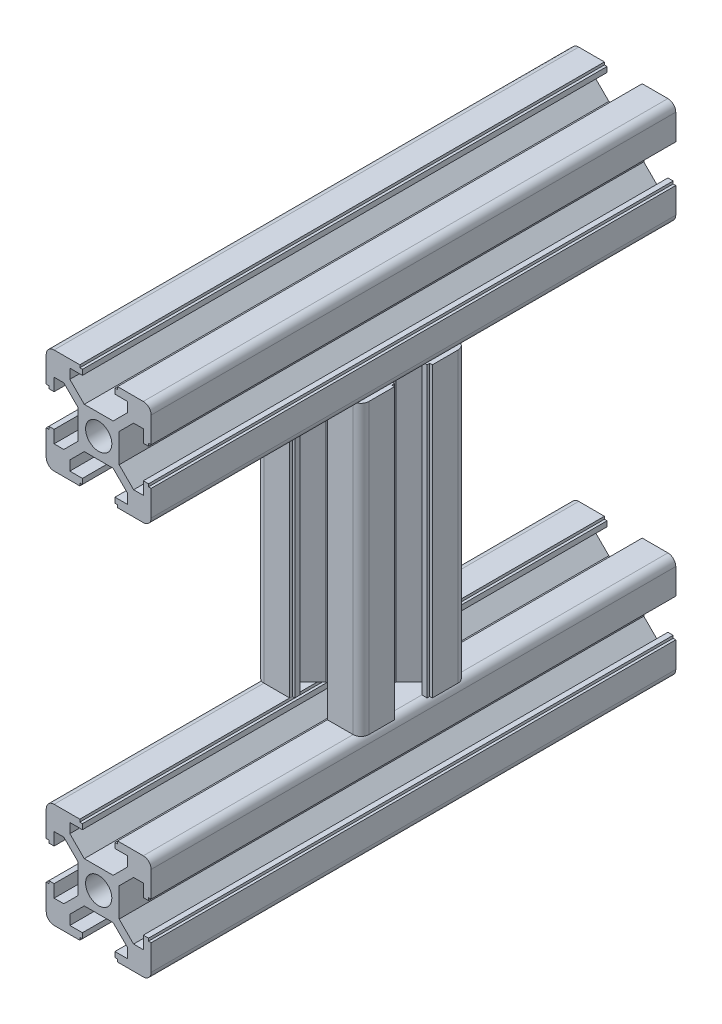
from build123d import *

# Parameters (mm, degrees)
SKETCH_3_R       = 2.5
EXTRUDE_3_DEPTH  = 100
EXTRUDE_START    = 10
SKETCH_6_R       = 2.5
EXTRUDE_9_DEPTH  = 55
EXTRUDE_START_2  = -53.9
SKETCH_7_R       = 2.5
EXTRUDE_10_DEPTH = 100


with BuildPart() as part:
    # 草图3 → 凸台-拉伸3 (new body)
    with BuildSketch(Plane.XY):
        with BuildLine():
            Line((-3.6, 10), (-3.6, 9.5))
            Line((-3.6, 9.5), (-3.1, 9.5))
            Line((-3.1, 9.5), (-3.1, 8.5))
            Line((-3.1, 8.5), (-5.5, 8.5))
            Line((-5.5, 8.5), (-5.5, 6.65))
            Line((-5.5, 6.65), (-2.75, 3.9))
            Line((-2.75, 3.9), (2.75, 3.9))
            Line((2.75, 3.9), (5.5, 6.65))
            Line((5.5, 6.65), (5.5, 8.5))
            Line((5.5, 8.5), (3.1, 8.5))
            Line((3.1, 8.5), (3.1, 9.5))
            Line((3.1, 9.5), (3.6, 9.5))
            Line((3.6, 9.5), (3.6, 10))
            Line((3.6, 10), (8.5, 10))
            ThreePointArc((8.5, 10), (9.560660172, 9.560660172), (10, 8.5))
            Line((10, 8.5), (10, 3.6))
            Line((10, 3.6), (9.5, 3.6))
            Line((9.5, 3.6), (9.5, 3.1))
            Line((9.5, 3.1), (8.5, 3.1))
            Line((8.5, 3.1), (8.5, 5.5))
            Line((8.5, 5.5), (6.65, 5.5))
            Line((6.65, 5.5), (3.9, 2.75))
            Line((3.9, 2.75), (3.9, -2.75))
            Line((3.9, -2.75), (6.65, -5.5))
            Line((6.65, -5.5), (8.5, -5.5))
            Line((8.5, -5.5), (8.5, -3.1))
            Line((8.5, -3.1), (9.5, -3.1))
            Line((9.5, -3.1), (9.5, -3.6))
            Line((9.5, -3.6), (10, -3.6))
            Line((10, -3.6), (10, -8.5))
            ThreePointArc((10, -8.5), (9.560660172, -9.560660172), (8.5, -10))
            Line((8.5, -10), (3.6, -10))
            Line((3.6, -10), (3.6, -9.5))
            Line((3.6, -9.5), (3.1, -9.5))
            Line((3.1, -9.5), (3.1, -8.5))
            Line((3.1, -8.5), (5.5, -8.5))
            Line((5.5, -8.5), (5.5, -6.65))
            Line((5.5, -6.65), (2.75, -3.9))
            Line((2.75, -3.9), (-2.75, -3.9))
            Line((-2.75, -3.9), (-5.5, -6.65))
            Line((-5.5, -6.65), (-5.5, -8.5))
            Line((-5.5, -8.5), (-3.1, -8.5))
            Line((-3.1, -8.5), (-3.1, -9.5))
            Line((-3.1, -9.5), (-3.6, -9.5))
            Line((-3.6, -9.5), (-3.6, -10))
            Line((-3.6, -10), (-8.5, -10))
            ThreePointArc((-8.5, -10), (-9.560660172, -9.560660172), (-10, -8.5))
            Line((-10, -8.5), (-10, -3.6))
            Line((-10, -3.6), (-9.5, -3.6))
            Line((-9.5, -3.6), (-9.5, -3.1))
            Line((-9.5, -3.1), (-8.5, -3.1))
            Line((-8.5, -3.1), (-8.5, -5.5))
            Line((-8.5, -5.5), (-6.65, -5.5))
            Line((-6.65, -5.5), (-3.9, -2.75))
            Line((-3.9, -2.75), (-3.9, 2.75))
            Line((-3.9, 2.75), (-6.65, 5.5))
            Line((-6.65, 5.5), (-8.5, 5.5))
            Line((-8.5, 5.5), (-8.5, 3.1))
            Line((-8.5, 3.1), (-9.5, 3.1))
            Line((-9.5, 3.1), (-9.5, 3.6))
            Line((-9.5, 3.6), (-10, 3.6))
            Line((-10, 3.6), (-10, 8.5))
            ThreePointArc((-10, 8.5), (-9.560660172, 9.560660172), (-8.5, 10))
            Line((-8.5, 10), (-3.6, 10))
        make_face()
        Circle(SKETCH_3_R, mode=Mode.SUBTRACT)
    extrude(amount=EXTRUDE_3_DEPTH)


with BuildPart() as body_2:
    # 草图6 → 凸台-拉伸9 (new body)
    with BuildSketch(Plane(origin=(0, 0, 0), x_dir=(1, 0, 0), z_dir=(0, 1, 0)).offset(EXTRUDE_START)):
        with BuildLine():
            Line((-3.6, -40), (-3.6, -40.5))
            Line((-3.6, -40.5), (-3.1, -40.5))
            Line((-3.1, -40.5), (-3.1, -41.5))
            Line((-3.1, -41.5), (-5.5, -41.5))
            Line((-5.5, -41.5), (-5.5, -43.35))
            Line((-5.5, -43.35), (-2.75, -46.1))
            Line((-2.75, -46.1), (2.75, -46.1))
            Line((2.75, -46.1), (5.5, -43.35))
            Line((5.5, -43.35), (5.5, -41.5))
            Line((5.5, -41.5), (3.1, -41.5))
            Line((3.1, -41.5), (3.1, -40.5))
            Line((3.1, -40.5), (3.6, -40.5))
            Line((3.6, -40.5), (3.6, -40))
            Line((3.6, -40), (8.5, -40))
            ThreePointArc((8.5, -40), (9.560660172, -40.439339828), (10, -41.5))
            Line((10, -41.5), (10, -46.4))
            Line((10, -46.4), (9.5, -46.4))
            Line((9.5, -46.4), (9.5, -46.9))
            Line((9.5, -46.9), (8.5, -46.9))
            Line((8.5, -46.9), (8.5, -44.5))
            Line((8.5, -44.5), (6.65, -44.5))
            Line((6.65, -44.5), (3.9, -47.25))
            Line((3.9, -47.25), (3.9, -52.75))
            Line((3.9, -52.75), (6.65, -55.5))
            Line((6.65, -55.5), (8.5, -55.5))
            Line((8.5, -55.5), (8.5, -53.1))
            Line((8.5, -53.1), (9.5, -53.1))
            Line((9.5, -53.1), (9.5, -53.6))
            Line((9.5, -53.6), (10, -53.6))
            Line((10, -53.6), (10, -58.5))
            ThreePointArc((10, -58.5), (9.560660172, -59.560660172), (8.5, -60))
            Line((8.5, -60), (3.6, -60))
            Line((3.6, -60), (3.6, -59.5))
            Line((3.6, -59.5), (3.1, -59.5))
            Line((3.1, -59.5), (3.1, -58.5))
            Line((3.1, -58.5), (5.5, -58.5))
            Line((5.5, -58.5), (5.5, -56.65))
            Line((5.5, -56.65), (2.75, -53.9))
            Line((2.75, -53.9), (-2.75, -53.9))
            Line((-2.75, -53.9), (-5.5, -56.65))
            Line((-5.5, -56.65), (-5.5, -58.5))
            Line((-5.5, -58.5), (-3.1, -58.5))
            Line((-3.1, -58.5), (-3.1, -59.5))
            Line((-3.1, -59.5), (-3.6, -59.5))
            Line((-3.6, -59.5), (-3.6, -60))
            Line((-3.6, -60), (-8.5, -60))
            ThreePointArc((-8.5, -60), (-9.560660172, -59.560660172), (-10, -58.5))
            Line((-10, -58.5), (-10, -53.6))
            Line((-10, -53.6), (-9.5, -53.6))
            Line((-9.5, -53.6), (-9.5, -53.1))
            Line((-9.5, -53.1), (-8.5, -53.1))
            Line((-8.5, -53.1), (-8.5, -55.5))
            Line((-8.5, -55.5), (-6.65, -55.5))
            Line((-6.65, -55.5), (-3.9, -52.75))
            Line((-3.9, -52.75), (-3.9, -47.25))
            Line((-3.9, -47.25), (-6.65, -44.5))
            Line((-6.65, -44.5), (-8.5, -44.5))
            Line((-8.5, -44.5), (-8.5, -46.9))
            Line((-8.5, -46.9), (-9.5, -46.9))
            Line((-9.5, -46.9), (-9.5, -46.4))
            Line((-9.5, -46.4), (-10, -46.4))
            Line((-10, -46.4), (-10, -41.5))
            ThreePointArc((-10, -41.5), (-9.560660172, -40.439339828), (-8.5, -40))
            Line((-8.5, -40), (-3.6, -40))
        make_face()
        with Locations((0, -50)):
            Circle(SKETCH_6_R, mode=Mode.SUBTRACT)
    extrude(amount=EXTRUDE_9_DEPTH)


with BuildPart() as body_3:
    # 草图7 → 凸台-拉伸10 (new body)
    with BuildSketch(Plane(origin=(0, 0, 46.1), x_dir=(-1, 0, 0), z_dir=(0, 0, -1)).offset(EXTRUDE_START_2)):
        with BuildLine():
            Line((-3.6, 85), (-3.6, 84.5))
            Line((-3.6, 84.5), (-3.1, 84.5))
            Line((-3.1, 84.5), (-3.1, 83.5))
            Line((-3.1, 83.5), (-5.5, 83.5))
            Line((-5.5, 83.5), (-5.5, 81.65))
            Line((-5.5, 81.65), (-2.75, 78.9))
            Line((-2.75, 78.9), (2.75, 78.9))
            Line((2.75, 78.9), (5.5, 81.65))
            Line((5.5, 81.65), (5.5, 83.5))
            Line((5.5, 83.5), (3.1, 83.5))
            Line((3.1, 83.5), (3.1, 84.5))
            Line((3.1, 84.5), (3.6, 84.5))
            Line((3.6, 84.5), (3.6, 85))
            Line((3.6, 85), (8.5, 85))
            ThreePointArc((8.5, 85), (9.560660172, 84.560660172), (10, 83.5))
            Line((10, 83.5), (10, 78.6))
            Line((10, 78.6), (9.5, 78.6))
            Line((9.5, 78.6), (9.5, 78.1))
            Line((9.5, 78.1), (8.5, 78.1))
            Line((8.5, 78.1), (8.5, 80.5))
            Line((8.5, 80.5), (6.65, 80.5))
            Line((6.65, 80.5), (3.9, 77.75))
            Line((3.9, 77.75), (3.9, 72.25))
            Line((3.9, 72.25), (6.65, 69.5))
            Line((6.65, 69.5), (8.5, 69.5))
            Line((8.5, 69.5), (8.5, 71.9))
            Line((8.5, 71.9), (9.5, 71.9))
            Line((9.5, 71.9), (9.5, 71.4))
            Line((9.5, 71.4), (10, 71.4))
            Line((10, 71.4), (10, 66.5))
            ThreePointArc((10, 66.5), (9.560660172, 65.439339828), (8.5, 65))
            Line((8.5, 65), (3.6, 65))
            Line((3.6, 65), (3.6, 65.5))
            Line((3.6, 65.5), (3.1, 65.5))
            Line((3.1, 65.5), (3.1, 66.5))
            Line((3.1, 66.5), (5.5, 66.5))
            Line((5.5, 66.5), (5.5, 68.35))
            Line((5.5, 68.35), (2.75, 71.1))
            Line((2.75, 71.1), (-2.75, 71.1))
            Line((-2.75, 71.1), (-5.5, 68.35))
            Line((-5.5, 68.35), (-5.5, 66.5))
            Line((-5.5, 66.5), (-3.1, 66.5))
            Line((-3.1, 66.5), (-3.1, 65.5))
            Line((-3.1, 65.5), (-3.6, 65.5))
            Line((-3.6, 65.5), (-3.6, 65))
            Line((-3.6, 65), (-8.5, 65))
            ThreePointArc((-8.5, 65), (-9.560660172, 65.439339828), (-10, 66.5))
            Line((-10, 66.5), (-10, 71.4))
            Line((-10, 71.4), (-9.5, 71.4))
            Line((-9.5, 71.4), (-9.5, 71.9))
            Line((-9.5, 71.9), (-8.5, 71.9))
            Line((-8.5, 71.9), (-8.5, 69.5))
            Line((-8.5, 69.5), (-6.65, 69.5))
            Line((-6.65, 69.5), (-3.9, 72.25))
            Line((-3.9, 72.25), (-3.9, 77.75))
            Line((-3.9, 77.75), (-6.65, 80.5))
            Line((-6.65, 80.5), (-8.5, 80.5))
            Line((-8.5, 80.5), (-8.5, 78.1))
            Line((-8.5, 78.1), (-9.5, 78.1))
            Line((-9.5, 78.1), (-9.5, 78.6))
            Line((-9.5, 78.6), (-10, 78.6))
            Line((-10, 78.6), (-10, 83.5))
            ThreePointArc((-10, 83.5), (-9.560660172, 84.560660172), (-8.5, 85))
            Line((-8.5, 85), (-3.6, 85))
        make_face()
        with Locations((0, 75)):
            Circle(SKETCH_7_R, mode=Mode.SUBTRACT)
    extrude(amount=EXTRUDE_10_DEPTH)


solid = Compound([part.part, body_2.part, body_3.part])
